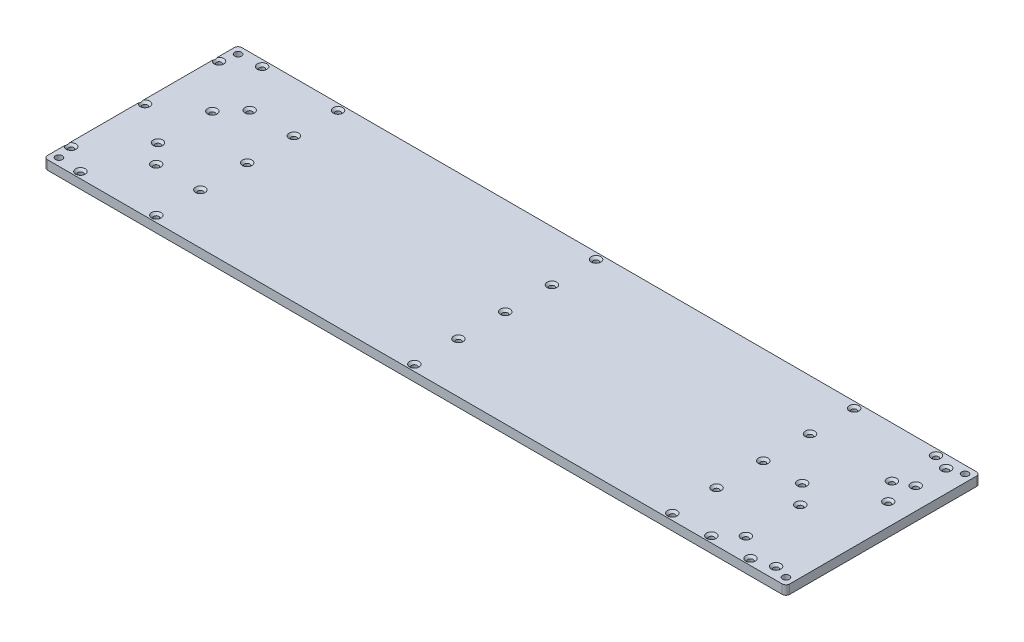
from build123d import *

# Parameters (mm, degrees)
SKETCH1_W                                       = 488.95
SKETCH1_H                                       = 128
BOSS_EXTRUDE1_DEPTH                             = 6
M4_CLEARANCE_HOLE1_D                            = 4.5
M4_CLEARANCE_HOLE1_DEPTH                        = 17.38
M4_CLEARANCE_HOLE1_TIP                          = 1.351936393
FILLET1_R                                       = 2.5
CSK_FOR_M3_FLAT_HEAD_MACHINE_SCREW1_D           = 3.4
CSK_FOR_M3_FLAT_HEAD_MACHINE_SCREW1_DEPTH       = 10
CSK_FOR_M3_FLAT_HEAD_MACHINE_SCREW1_CSINK_D     = 6.3
CSK_FOR_M3_FLAT_HEAD_MACHINE_SCREW1_CSINK_ANGLE = 90
CSK_FOR_M3_FLAT_HEAD_MACHINE_SCREW1_TIP         = 1.021463052


with BuildPart() as part:
    # Sketch1 → Boss-Extrude1 (new body)
    with BuildSketch(Plane(origin=(0, 0, 0), x_dir=(1, 0, 0), z_dir=(0, 1, 0))):
        Rectangle(SKETCH1_W, SKETCH1_H)
    extrude(amount=BOSS_EXTRUDE1_DEPTH)

    # M4 Clearance Hole1
    with Locations(Plane(origin=(0, 6, 0), x_dir=(1, 0, 0), z_dir=(0, 1, 0))):
        with Locations((-239.475, 59), (-239.475, -59), (239.475, -59), (239.475, 59)):
            Hole(M4_CLEARANCE_HOLE1_D / 2, depth=M4_CLEARANCE_HOLE1_DEPTH)
            with Locations((0, 0, -(M4_CLEARANCE_HOLE1_DEPTH + M4_CLEARANCE_HOLE1_TIP / 2))):  # 118° drill point
                Cone(0, M4_CLEARANCE_HOLE1_D / 2, M4_CLEARANCE_HOLE1_TIP, mode=Mode.SUBTRACT)

    # Fillet1
    fillet1_edges = [part.edges().sort_by_distance(p)[0] for p in [
        (244.475, 3, 64),
        (-244.475, 3, 64),
        (-244.475, 3, -64),
        (244.475, 3, -64),
    ]]
    fillet(fillet1_edges, radius=FILLET1_R)

    # CSK for M3 Flat Head Machine Screw1
    with Locations(Plane(origin=(0, 6, 0), x_dir=(1, 0, 0), z_dir=(0, 1, 0))):
        with Locations((-241.725, 0), (-241.725, -48.7), (-224.475, -59.85), (-174.475, -59.85), (-203.675, -30.8), (-215.325, -17.9), (-215.325, 17.9), (-203.675, 30.8), (-224.475, 59.85), (-241.725, 48.7), (-4.475, -59.85), (165.525, -59.85), (202.825, -48.7), (191.175, -59.85), (216.975, -59.85), (229.975, -56), (-174.475, 0), (-174.475, 30.8), (-174.475, -30.8), (-174.475, 59.85), (-4.475, 59.85), (165.525, 59.85), (229.975, 36), (219.475, 59.85), (229.975, 56), (165.525, 30.8), (191.175, 0), (202.825, -12.9), (165.525, 0), (229.975, 17.9), (219.475, 30.8), (165.525, -30.8), (-4.475, 30.8), (-4.475, 0), (-4.475, -30.8)):
            CounterSinkHole(CSK_FOR_M3_FLAT_HEAD_MACHINE_SCREW1_D / 2, CSK_FOR_M3_FLAT_HEAD_MACHINE_SCREW1_CSINK_D / 2, depth=CSK_FOR_M3_FLAT_HEAD_MACHINE_SCREW1_DEPTH, counter_sink_angle=CSK_FOR_M3_FLAT_HEAD_MACHINE_SCREW1_CSINK_ANGLE)
            with Locations((0, 0, -(CSK_FOR_M3_FLAT_HEAD_MACHINE_SCREW1_DEPTH + CSK_FOR_M3_FLAT_HEAD_MACHINE_SCREW1_TIP / 2))):  # 118° drill point
                Cone(0, CSK_FOR_M3_FLAT_HEAD_MACHINE_SCREW1_D / 2, CSK_FOR_M3_FLAT_HEAD_MACHINE_SCREW1_TIP, mode=Mode.SUBTRACT)


solid = part.part
